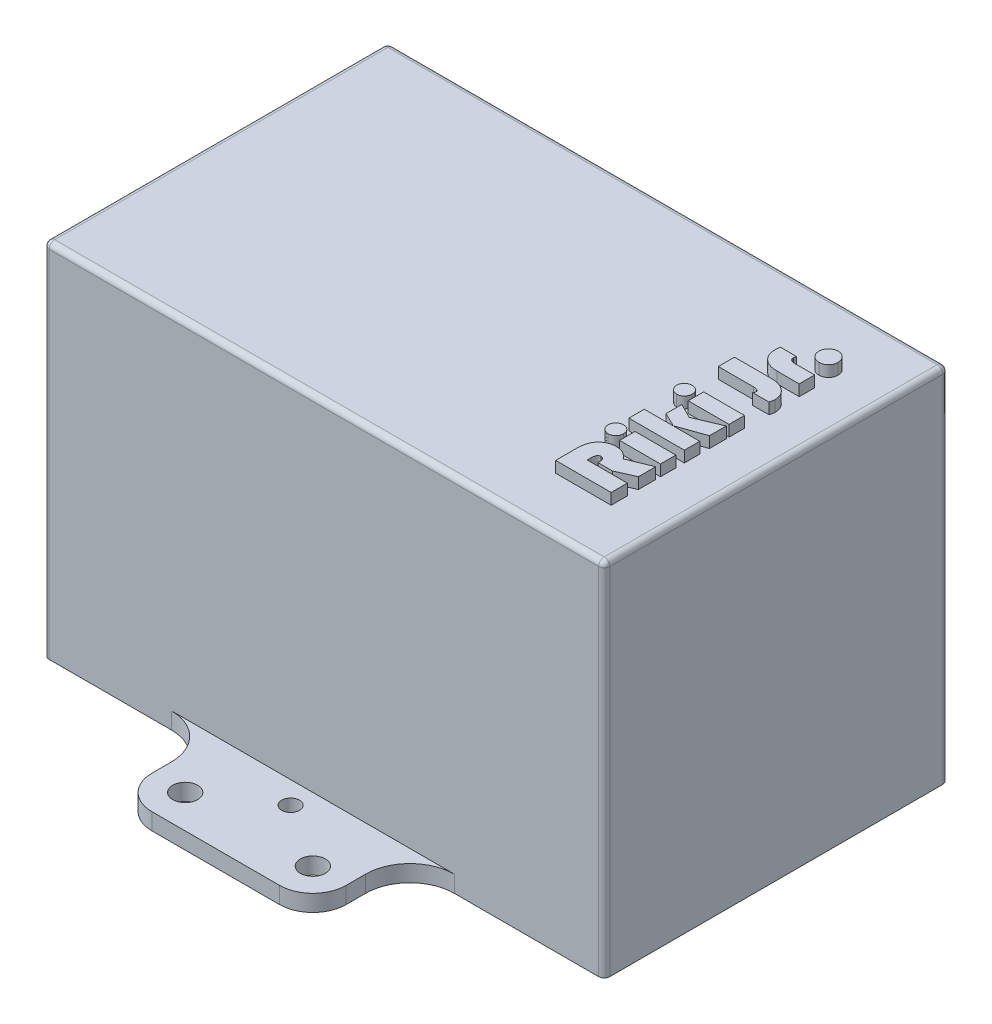
from build123d import *

# Parameters (mm, degrees)
SKETCH1_R           = 2.25
SKETCH1_R_2         = 1.6
BOSS_EXTRUDE1_DEPTH = 3
BOSS_EXTRUDE2_DEPTH = 55
SKETCH3_W           = 101
SKETCH3_H           = 62
SKETCH3_W_2         = 97
SKETCH3_H_2         = 58
BOSS_EXTRUDE3_DEPTH = 5
SKETCH4_W           = 101
SKETCH4_H           = 62
BOSS_EXTRUDE4_DEPTH = 2
FILLET1_R           = 1
SKETCH5_W           = 7.361111111
SKETCH5_H           = 2.777777778
SKETCH5_W_2         = 10
SKETCH5_H_2         = 2.777777777
BOSS_EXTRUDE5_DEPTH = 2


with BuildPart() as part:
    # Sketch1 → Boss-Extrude1 (new body)
    with BuildSketch(Plane(origin=(0, 0, 0), x_dir=(1, 0, 0), z_dir=(0, 1, 0))):
        with BuildLine():
            Line((-50.5, -31), (-50.5, -7.5))
            Line((-50.5, -7.5), (-48.5, -7.5))
            Line((-48.5, -7.5), (-48.5, -29))
            Line((-48.5, -29), (48.5, -29))
            Line((48.5, -29), (48.5, 29))
            Line((48.5, 29), (-48.5, 29))
            Line((-48.5, 29), (-48.5, 7.5))
            Line((-48.5, 7.5), (-50.5, 7.5))
            Line((-50.5, 7.5), (-50.5, 31))
            Line((-50.5, 31), (-27.5, 31))
            ThreePointArc((-27.5, 31), (-21.843145751, 33.343145751), (-19.5, 39))
            Line((-19.5, 39), (-19.5, 42.5))
            ThreePointArc((-19.5, 42.5), (-17.742640687, 46.742640687), (-13.5, 48.5))
            Line((-13.5, 48.5), (9.5, 48.5))
            ThreePointArc((9.5, 48.5), (13.742640687, 46.742640687), (15.5, 42.5))
            Line((15.5, 42.5), (15.5, 39))
            ThreePointArc((15.5, 39), (17.843145751, 33.343145751), (23.5, 31))
            Line((23.5, 31), (50.5, 31))
            Line((50.5, 31), (50.5, -31))
            Line((50.5, -31), (23.5, -31))
            ThreePointArc((23.5, -31), (17.843145751, -33.343145751), (15.5, -39))
            Line((15.5, -39), (15.5, -42.5))
            ThreePointArc((15.5, -42.5), (13.742640687, -46.742640687), (9.5, -48.5))
            Line((9.5, -48.5), (-13.5, -48.5))
            ThreePointArc((-13.5, -48.5), (-17.742640687, -46.742640687), (-19.5, -42.5))
            Line((-19.5, -42.5), (-19.5, -39))
            ThreePointArc((-19.5, -39), (-21.843145751, -33.343145751), (-27.5, -31))
            Line((-27.5, -31), (-50.5, -31))
        make_face()
        with Locations(Location((-13.5, -42.5, 0), (0, 0, 270))):
            Circle(SKETCH1_R, mode=Mode.SUBTRACT)
        with Locations(Location((9.5, -42.5, 0), (0, 0, 270))):
            Circle(SKETCH1_R, mode=Mode.SUBTRACT)
        with Locations(Location((9.5, 42.5, 0), (0, 0, 90))):
            Circle(SKETCH1_R, mode=Mode.SUBTRACT)
        with Locations(Location((-13.5, 42.5, 0), (0, 0, 90))):
            Circle(SKETCH1_R, mode=Mode.SUBTRACT)
        with Locations(Location((-2, -35, 0), (0, 0, 270))):
            Circle(SKETCH1_R_2, mode=Mode.SUBTRACT)
        with Locations(Location((-2, 35, 0), (0, 0, 90))):
            Circle(SKETCH1_R_2, mode=Mode.SUBTRACT)
    extrude(amount=BOSS_EXTRUDE1_DEPTH)

    # Sketch2 → Boss-Extrude2 (add)
    with BuildSketch(Plane(origin=(0, 3, 0), x_dir=(1, 0, 0), z_dir=(0, 1, 0))):
        Polygon((-50.5, 31), (-50.5, 7.5), (-48.5, 7.5), (-48.5, 29), (48.5, 29), (48.5, -29), (-48.5, -29), (-48.5, -7.5), (-50.5, -7.5), (-50.5, -31), (50.5, -31), (50.5, 31), align=None)
    extrude(amount=BOSS_EXTRUDE2_DEPTH)

    # Sketch3 → Boss-Extrude3 (add)
    with BuildSketch(Plane(origin=(0, 58, 0), x_dir=(1, 0, 0), z_dir=(0, 1, 0))):
        Rectangle(SKETCH3_W, SKETCH3_H)
        Rectangle(SKETCH3_W_2, SKETCH3_H_2, mode=Mode.SUBTRACT)
    extrude(amount=BOSS_EXTRUDE3_DEPTH)

    # Sketch4 → Boss-Extrude4 (add)
    with BuildSketch(Plane(origin=(0, 63, 0), x_dir=(1, 0, 0), z_dir=(0, 1, 0))):
        Rectangle(SKETCH4_W, SKETCH4_H)
    extrude(amount=BOSS_EXTRUDE4_DEPTH)

    # Fillet1
    fillet1_edges = [part.edges().sort_by_distance(p)[0] for p in [
        (-50.5, 65, 0),
        (0, 65, 31),
        (50.5, 65, 0),
        (0, 65, -31),
        (-50.5, 32.5, -31),
        (50.5, 32.5, -31),
        (50.5, 32.5, 31),
        (-50.5, 32.5, 31),
    ]]
    fillet(fillet1_edges, radius=FILLET1_R)

    # Sketch5 → Boss-Extrude5 (add)
    with BuildSketch(Plane(origin=(0, 65, 0), x_dir=(1, 0, 0), z_dir=(0, 1, 0))):
        with BuildLine():
            Line((34.842719315, -18.402777778), (42.064941537, -18.402777778))
            Line((42.064941537, -18.402777778), (42.064941537, -21.319444444))
            Line((42.064941537, -21.319444444), (32.064941537, -21.319444444))
            Line((32.064941537, -21.319444444), (32.064941537, -17.443576389))
            add(Edge.make_bspline(
                [(32.064941537, -17.443576389), (32.067073684, -17.302404298), (32.071216573, -17.028098483), (32.113810667, -16.629196213), (32.180253744, -16.254697514), (32.27275909, -15.903357969), (32.394325472, -15.576997984), (32.542577609, -15.274855811), (32.717960466, -14.996710837), (32.857281196, -14.830718226), (32.926486676, -14.748263889)],
                knots=[0, 0, 0, 0, 1.170182211, 2.273734029, 3.322028896, 4.321571556, 5.281941424, 6.204712928, 7.108218099, 8, 8, 8, 8], degree=3))
            add(Edge.make_bspline(
                [(32.926486676, -14.748263889), (33.007184415, -14.663216378), (33.166495599, -14.495317995), (33.433919377, -14.278135812), (33.716228626, -14.092184227), (34.016045233, -13.942173902), (34.33054041, -13.823092501), (34.662219731, -13.74210864), (35.009644249, -13.69037441), (35.246899901, -13.683871724), (35.367892926, -13.680555556)],
                knots=[0, 0, 0, 0, 1.022675042, 2.01893604, 2.999885637, 3.968663029, 4.939948668, 5.929460723, 6.94408917, 8, 8, 8, 8], degree=3))
            add(Edge.make_bspline(
                [(35.367892926, -13.680555556), (35.491907302, -13.683704934), (35.735824598, -13.689899281), (36.092971567, -13.757094564), (36.436569058, -13.857189646), (36.763438077, -14.005232982), (37.076481244, -14.191445965), (37.375360916, -14.418029261), (37.65620735, -14.68969159), (37.826332188, -14.893463186), (37.913465843, -14.997829861)],
                knots=[0, 0, 0, 0, 0.999835404, 1.966523196, 2.923427595, 3.882662808, 4.853994781, 5.858304124, 6.90307735, 8, 8, 8, 8], degree=3))
            Line((37.913465843, -14.997829861), (42.064941537, -13.283420139))
            Line((42.064941537, -13.283420139), (42.064941537, -16.404079861))
            Line((42.064941537, -16.404079861), (38.820583898, -17.847222222))
            Line((38.820583898, -17.847222222), (36.231608204, -17.847222222))
            Line((36.231608204, -17.847222222), (36.231608204, -17.612847222))
            add(Edge.make_bspline(
                [(36.231608204, -17.612847222), (36.229967958, -17.533149485), (36.226892667, -17.383724503), (36.193189314, -17.175060377), (36.134634364, -16.998340997), (36.055260969, -16.850394726), (35.947580666, -16.736256975), (35.817735549, -16.652866072), (35.662725487, -16.604147358), (35.551987783, -16.599608691), (35.493760982, -16.597222222)],
                knots=[0, 0, 0, 0, 1.338544749, 2.509632417, 3.536008039, 4.455779154, 5.307135793, 6.143432282, 7.023801334, 8, 8, 8, 8], degree=3))
            add(Edge.make_bspline(
                [(35.493760982, -16.597222222), (35.442559518, -16.600044662), (35.343449689, -16.605508012), (35.205225563, -16.663305823), (35.088369319, -16.757971594), (34.997410315, -16.891639329), (34.925423186, -17.057856308), (34.878216839, -17.260574573), (34.848339389, -17.497659448), (34.844671773, -17.667716518), (34.842719315, -17.758246528)],
                knots=[0, 0, 0, 0, 0.819953673, 1.587170802, 2.36508198, 3.207923993, 4.161519284, 5.265154948, 6.54410317, 8, 8, 8, 8], degree=3))
            Line((34.842719315, -17.758246528), (34.842719315, -18.402777778))
        make_face()
        with Locations((38.384385982, -11.041666667)):
            Rectangle(SKETCH5_W, SKETCH5_H)
        with BuildLine():
            add(Edge.make_bspline(
                [(31.231608204, -11.041666667), (31.236312344, -10.949894388), (31.245566128, -10.76936388), (31.328373316, -10.510469598), (31.458305387, -10.27020627), (31.641043638, -10.059687665), (31.854746474, -9.880094442), (32.094788371, -9.746157825), (32.356731826, -9.667801052), (32.537520205, -9.657831975), (32.629177648, -9.652777778)],
                knots=[0, 0, 0, 0, 1.006607357, 1.980155019, 2.958886333, 3.991455108, 5.025003492, 6.01453209, 6.993392643, 8, 8, 8, 8], degree=3))
            add(Edge.make_bspline(
                [(32.629177648, -9.652777778), (32.725936733, -9.656738649), (32.913125033, -9.664401277), (33.179439377, -9.741687299), (33.419579366, -9.864804963), (33.62678671, -10.037003157), (33.797155741, -10.245412999), (33.921511338, -10.485998083), (33.997369761, -10.755006359), (34.005301574, -10.94422859), (34.009385982, -11.041666667)],
                knots=[0, 0, 0, 0, 1.056426831, 2.043743411, 3.006770094, 3.990939967, 4.970098873, 5.933125556, 6.935683875, 8, 8, 8, 8], degree=3))
            add(Edge.make_bspline(
                [(34.009385982, -11.041666667), (34.005333213, -11.139118955), (33.99746284, -11.328368782), (33.920992631, -11.59780591), (33.797746558, -11.839604224), (33.627409027, -12.048600991), (33.418826684, -12.218308133), (33.179532455, -12.341762979), (32.913099595, -12.418900096), (32.725928065, -12.426583793), (32.629177648, -12.430555556)],
                knots=[0, 0, 0, 0, 1.064047005, 2.06635182, 3.036167552, 4.015078871, 4.993990189, 5.956773364, 6.943840294, 8, 8, 8, 8], degree=3))
            add(Edge.make_bspline(
                [(32.629177648, -12.430555556), (32.537422748, -12.425780927), (32.356233294, -12.416352413), (32.095851518, -12.333895992), (31.854029603, -12.203895055), (31.641259992, -12.023358459), (31.457490808, -11.812887), (31.329444106, -11.571654967), (31.245169579, -11.313407847), (31.236190355, -11.133483256), (31.231608204, -11.041666667)],
                knots=[0, 0, 0, 0, 1.006875565, 1.988288713, 2.974269441, 4.008093211, 5.040937112, 6.02691784, 6.993124435, 8, 8, 8, 8], degree=3))
        make_face()
        with Locations((37.064941537, -6.736111111)):
            Rectangle(SKETCH5_W_2, SKETCH5_H)
        Polygon((34.703830426, -1.223958333), (37.383951954, -2.565104167), (42.064941537, -0.572916667), (42.064941537, -3.604600694), (37.258083898, -5.319010417), (34.703830426, -4.073350694), align=None)
        with Locations((38.384385982, 1.319444444)):
            Rectangle(SKETCH5_W, SKETCH5_H_2)
        with BuildLine():
            add(Edge.make_bspline(
                [(31.231608204, 1.319444444), (31.236312344, 1.411216723), (31.245566128, 1.591747232), (31.328373316, 1.850641513), (31.458305387, 2.090904841), (31.641043638, 2.301423446), (31.854746474, 2.481016669), (32.094788371, 2.614953286), (32.356731826, 2.693310059), (32.537520205, 2.703279136), (32.629177648, 2.708333333)],
                knots=[0, 0, 0, 0, 1.006607357, 1.980155019, 2.958886333, 3.991455108, 5.025003492, 6.01453209, 6.993392643, 8, 8, 8, 8], degree=3))
            add(Edge.make_bspline(
                [(32.629177648, 2.708333333), (32.725936733, 2.704372462), (32.913125033, 2.696709834), (33.179439377, 2.619423812), (33.419579366, 2.496306148), (33.62678671, 2.324107955), (33.797155741, 2.115698112), (33.921511338, 1.875113028), (33.997369761, 1.606104752), (34.005301574, 1.416882522), (34.009385982, 1.319444444)],
                knots=[0, 0, 0, 0, 1.056426831, 2.043743411, 3.006770094, 3.990939967, 4.970098873, 5.933125556, 6.935683875, 8, 8, 8, 8], degree=3))
            add(Edge.make_bspline(
                [(34.009385982, 1.319444444), (34.005333213, 1.221992156), (33.99746284, 1.032742329), (33.920992631, 0.763305201), (33.797746558, 0.521506887), (33.627409027, 0.31251012), (33.418826684, 0.142802978), (33.179532455, 0.019348132), (32.913099595, -0.057788985), (32.725928065, -0.065472682), (32.629177648, -0.069444444)],
                knots=[0, 0, 0, 0, 1.064047005, 2.06635182, 3.036167552, 4.015078871, 4.993990189, 5.956773364, 6.943840294, 8, 8, 8, 8], degree=3))
            add(Edge.make_bspline(
                [(32.629177648, -0.069444444), (32.537422748, -0.064669816), (32.356233294, -0.055241302), (32.095851518, 0.027215119), (31.854029603, 0.157216056), (31.641259992, 0.337752652), (31.457490808, 0.548224111), (31.329444106, 0.789456145), (31.245169579, 1.047703264), (31.236190355, 1.227627855), (31.231608204, 1.319444444)],
                knots=[0, 0, 0, 0, 1.006875565, 1.988288713, 2.974269441, 4.008093211, 5.040937112, 6.02691784, 6.993124435, 8, 8, 8, 8], degree=3))
        make_face()
        with BuildLine():
            Line((32.064941537, 10.902777778), (38.77935126, 10.902777778))
            add(Edge.make_bspline(
                [(38.77935126, 10.902777778), (38.905313622, 10.900310333), (39.152798888, 10.895462406), (39.515875968, 10.856358592), (39.86202262, 10.788961965), (40.19108335, 10.695761274), (40.502923321, 10.576312484), (40.797520803, 10.429641273), (41.077013466, 10.258438602), (41.335179443, 10.059031151), (41.570958744, 9.842156777), (41.777116256, 9.608117571), (41.951982467, 9.359333378), (42.095971682, 9.096045638), (42.207676328, 8.818519855), (42.285239809, 8.526959434), (42.335061755, 8.221477678), (42.340134901, 8.012351292), (42.342719315, 7.905815972)],
                knots=[0, 0, 0, 0, 1.161527154, 2.282117058, 3.362855343, 4.410298666, 5.432450991, 6.437920446, 7.441418107, 8.450202087, 9.441584645, 10.391772722, 11.320906307, 12.240433511, 13.15347594, 14.072712676, 15.018181422, 16, 16, 16, 16], degree=3))
            add(Edge.make_bspline(
                [(42.342719315, 7.905815972), (42.339817237, 7.839124477), (42.333753279, 7.699771112), (42.294645851, 7.48381417), (42.230708503, 7.252691602), (42.173187928, 7.095962241), (42.143066537, 7.013888889)],
                knots=[0, 0, 0, 0, 0.871096052, 1.820174618, 2.858506324, 4, 4, 4, 4], degree=3))
            Line((42.143066537, 7.013888889), (39.245931121, 7.013888889))
            add(Edge.make_bspline(
                [(39.245931121, 7.013888889), (39.273026972, 7.048650243), (39.324058792, 7.114119127), (39.38015027, 7.21661281), (39.419792972, 7.31414535), (39.42402129, 7.379585638), (39.426052648, 7.411024306)],
                knots=[0, 0, 0, 0, 1.188581129, 2.238551427, 3.153769063, 4, 4, 4, 4], degree=3))
            add(Edge.make_bspline(
                [(39.426052648, 7.411024306), (39.423781188, 7.456417987), (39.419372958, 7.54451363), (39.366115963, 7.665887625), (39.281243991, 7.767552109), (39.164608983, 7.851540466), (39.014252867, 7.91259737), (38.833221923, 7.95381229), (38.621847585, 7.982881475), (38.469861097, 7.984987078), (38.38872626, 7.986111111)],
                knots=[0, 0, 0, 0, 0.815581159, 1.582800594, 2.344319871, 3.186188558, 4.152506549, 5.255789579, 6.535060119, 8, 8, 8, 8], degree=3))
            Line((38.38872626, 7.986111111), (32.064941537, 7.986111111))
            Line((32.064941537, 7.986111111), (32.064941537, 10.902777778))
        make_face()
        with BuildLine():
            Line((34.632215843, 16.597222222), (37.583604732, 16.597222222))
            add(Edge.make_bspline(
                [(37.583604732, 16.597222222), (37.554181042, 16.50831661), (37.499034057, 16.341686371), (37.487151036, 16.166694399), (37.481608204, 16.085069444)],
                knots=[0, 0, 0, 0, 1.067100588, 2, 2, 2, 2], degree=3))
            add(Edge.make_bspline(
                [(37.481608204, 16.085069444), (37.484790913, 16.026851923), (37.490852836, 15.915968336), (37.54108728, 15.759583599), (37.632281484, 15.630186674), (37.75501719, 15.523576065), (37.912985046, 15.442859595), (38.103284604, 15.386098094), (38.327466716, 15.351807338), (38.487695757, 15.348817493), (38.573188065, 15.347222222)],
                knots=[0, 0, 0, 0, 0.934586087, 1.780052722, 2.599053896, 3.447631367, 4.368012638, 5.426913624, 6.627095986, 8, 8, 8, 8], degree=3))
            Line((38.573188065, 15.347222222), (42.064941537, 15.347222222))
            Line((42.064941537, 15.347222222), (42.064941537, 12.569444444))
            Line((42.064941537, 12.569444444), (38.041504037, 12.569444444))
            add(Edge.make_bspline(
                [(38.041504037, 12.569444444), (37.912615826, 12.571600996), (37.660655186, 12.575816791), (37.292883918, 12.618760716), (36.943948225, 12.684468379), (36.615746335, 12.78038482), (36.30689388, 12.901720878), (36.019624771, 13.0527748), (35.750487488, 13.228198519), (35.506410593, 13.433326396), (35.283896068, 13.65758586), (35.092812397, 13.905000987), (34.927720063, 14.168692979), (34.796070382, 14.452915601), (34.690851, 14.753592113), (34.617628445, 15.072335732), (34.573654452, 15.408922628), (34.567893225, 15.639331562), (34.564941537, 15.757378472)],
                knots=[0, 0, 0, 0, 1.161849774, 2.271273755, 3.33445082, 4.360473363, 5.350182882, 6.321840153, 7.282596283, 8.241468033, 9.191757856, 10.126082875, 11.054765687, 11.991547066, 12.944698675, 13.922620754, 14.935682756, 16, 16, 16, 16], degree=3))
            add(Edge.make_bspline(
                [(34.564941537, 15.757378472), (34.56584307, 15.815273081), (34.567772003, 15.939145184), (34.582875414, 16.137283336), (34.600546686, 16.359747478), (34.621325617, 16.515560638), (34.632215843, 16.597222222)],
                knots=[0, 0, 0, 0, 0.823982736, 1.763004811, 2.827592166, 4, 4, 4, 4], degree=3))
        make_face()
        with BuildLine():
            add(Edge.make_bspline(
                [(38.731608204, 19.43359375), (38.733438492, 19.492256637), (38.737046552, 19.607899256), (38.760794762, 19.778310974), (38.803142699, 19.942177487), (38.858677035, 20.100339397), (38.931772649, 20.2521461), (39.019958008, 20.397796201), (39.128610586, 20.534692089), (39.248468241, 20.665808607), (39.379114268, 20.786667151), (39.519200331, 20.891344292), (39.665154781, 20.980879599), (39.816848704, 21.054804591), (39.975197847, 21.112645941), (40.140090541, 21.150278599), (40.310708984, 21.175381169), (40.426395348, 21.178814105), (40.485080426, 21.180555556)],
                knots=[0, 0, 0, 0, 1.024874562, 2.020343438, 2.998087414, 3.977381877, 4.943955025, 5.936612403, 6.945229927, 7.991692903, 9.038155879, 10.049145693, 11.041803071, 12.025247278, 12.992646204, 13.979656562, 14.975125438, 16, 16, 16, 16], degree=3))
            add(Edge.make_bspline(
                [(40.485080426, 21.180555556), (40.543761396, 21.178796609), (40.659439663, 21.175329185), (40.829419676, 21.150580463), (40.993422683, 21.112257485), (41.14961939, 21.055383113), (41.299432383, 20.982698514), (41.442113169, 20.894107661), (41.577304723, 20.788561167), (41.705129857, 20.670106922), (41.820026236, 20.53894865), (41.924026793, 20.40140096), (42.010546819, 20.256552448), (42.080465269, 20.104082934), (42.137674992, 19.946281803), (42.17647529, 19.780950814), (42.19800775, 19.609220049), (42.201861887, 19.492969764), (42.203830426, 19.43359375)],
                knots=[0, 0, 0, 0, 1.032782167, 2.035931763, 3.018169904, 3.993032971, 4.955591002, 5.945067304, 6.943598733, 7.970791231, 9.008273584, 10.009238284, 11.0029669, 11.97157142, 12.958421806, 13.953047622, 14.954498265, 16, 16, 16, 16], degree=3))
            add(Edge.make_bspline(
                [(42.203830426, 19.43359375), (42.203074133, 19.371998661), (42.201590975, 19.251205159), (42.175382403, 19.075137692), (42.140725941, 18.906347641), (42.083931674, 18.747679734), (42.019104954, 18.594429376), (41.93143864, 18.453421075), (41.834702385, 18.316951878), (41.719918765, 18.192822074), (41.593774453, 18.080102756), (41.460286863, 17.979742319), (41.316308857, 17.896576802), (41.165687188, 17.826596645), (41.004886435, 17.775428385), (40.837654623, 17.734898838), (40.660640861, 17.714330784), (40.54009884, 17.710360105), (40.47857001, 17.708333333)],
                knots=[0, 0, 0, 0, 1.079747587, 2.117482015, 3.118537959, 4.09811231, 5.070006196, 6.032317973, 7.004874929, 8.002301948, 8.991209687, 9.971277485, 10.927119724, 11.904223102, 12.879758293, 13.883627665, 14.919730129, 16, 16, 16, 16], degree=3))
            add(Edge.make_bspline(
                [(40.47857001, 17.708333333), (40.418446848, 17.71007892), (40.300612927, 17.713500054), (40.127678243, 17.738133663), (39.962037207, 17.777219038), (39.802228824, 17.831143464), (39.650150859, 17.903829952), (39.504271647, 17.990248304), (39.366828278, 18.093668697), (39.23719835, 18.210185681), (39.118709499, 18.338353088), (39.017734441, 18.476889825), (38.925313895, 18.617078888), (38.858026598, 18.76929634), (38.799600946, 18.925098573), (38.76166684, 19.089296342), (38.736812779, 19.259223597), (38.733359815, 19.374909106), (38.731608204, 19.43359375)],
                knots=[0, 0, 0, 0, 1.055760603, 2.069159537, 3.061472187, 4.041837701, 5.025080483, 6.016498022, 7.015134814, 8.040725689, 9.074859058, 10.07349585, 11.049901608, 12.016253479, 12.988849343, 13.968803129, 14.969619736, 16, 16, 16, 16], degree=3))
        make_face()
    extrude(amount=BOSS_EXTRUDE5_DEPTH)


solid = part.part
